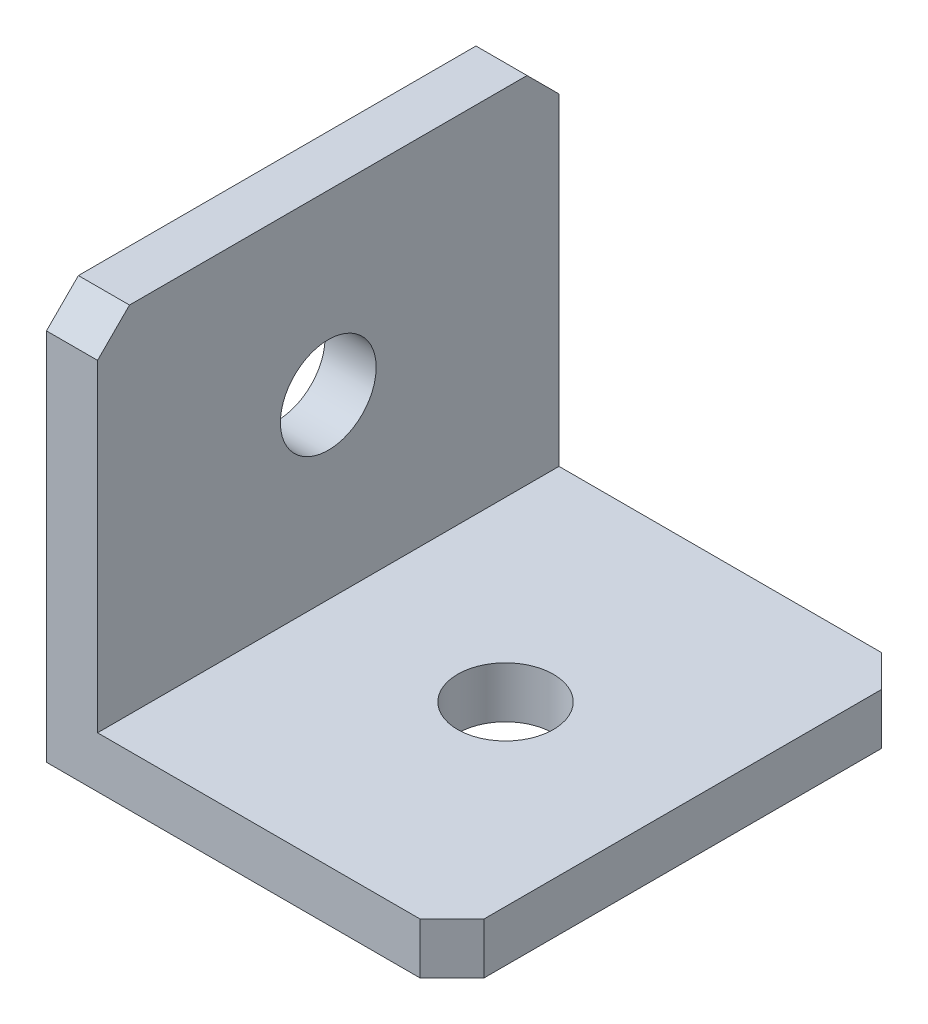
from build123d import *

# Parameters (mm, degrees)
RESSALTO_EXTRUS_O1_DEPTH = 28.9
CHANFRO1_SIZE            = 2
ESBO_O2_R                = 3
CORTE_EXTRUS_O1_DEPTH    = 43.671887701
ESBO_O3_R                = 3
CORTE_EXTRUS_O2_DEPTH    = 43.671887701


with BuildPart() as part:
    # Esboço1 → Ressalto-extrusão1 (new body)
    with BuildSketch(Plane.XY):
        Polygon((0, 0), (0, 22.2), (-3.2, 22.2), (-3.2, -3.2), (22.2, -3.2), (22.2, 0), align=None)
    extrude(amount=RESSALTO_EXTRUS_O1_DEPTH)

    # Chanfro1
    chanfro1_edges = [part.edges().sort_by_distance(p)[0] for p in [
        (-1.6, 22.2, 28.9),
        (22.2, -1.6, 28.9),
        (22.2, -1.6, 0),
        (-1.6, 22.2, 0),
    ]]
    chamfer(chanfro1_edges, length=CHANFRO1_SIZE)

    # Esboço2 → Corte-extrusão1 (cut, through all)
    with BuildSketch(Plane(origin=(0, 0, 0), x_dir=(1, 0, 0), z_dir=(0, 1, 0))):
        with Locations(Location((11.1, -14.45, 0), (0, 0, 180))):
            Circle(ESBO_O2_R)
    extrude(amount=-CORTE_EXTRUS_O1_DEPTH, mode=Mode.SUBTRACT)

    # Esboço3 → Corte-extrusão2 (cut, through all)
    with BuildSketch(Plane(origin=(0, 0, 0), x_dir=(0, 0, -1), z_dir=(1, 0, 0))):
        with Locations(Location((-14.45, 11.1, 0), (0, 0, 90))):
            Circle(ESBO_O3_R)
    extrude(amount=-CORTE_EXTRUS_O2_DEPTH, mode=Mode.SUBTRACT)


solid = part.part
